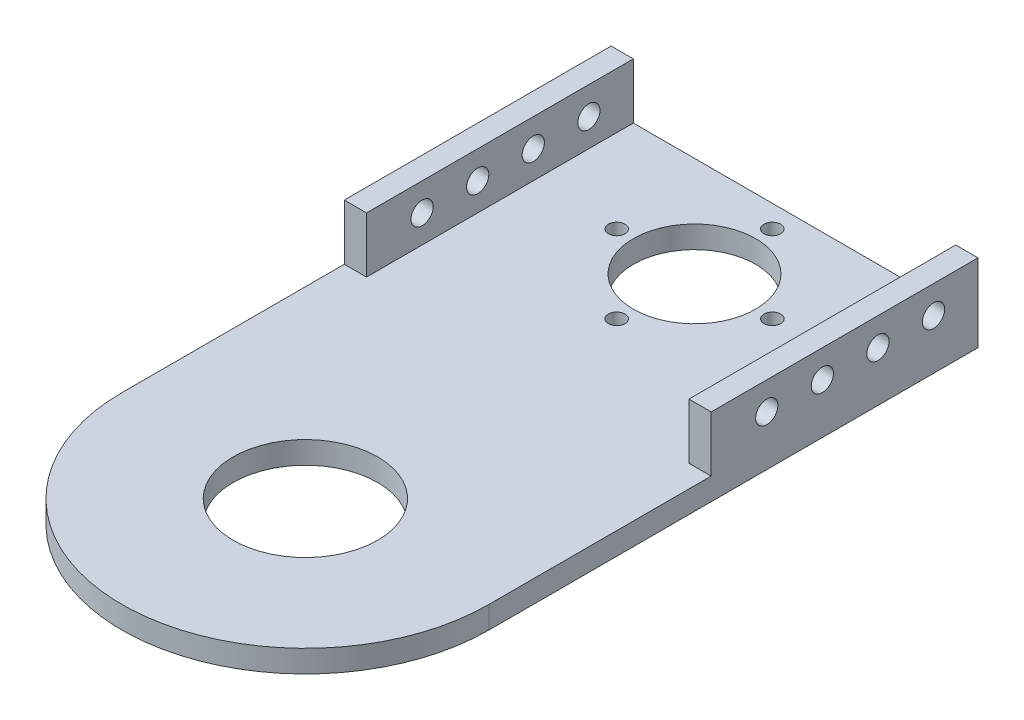
from build123d import *

# Parameters (mm, degrees)
EXTRUDE_1_DEPTH     = 30
CUT_EXTRUDE_1_REACH = 75.838
SKETCH_2_R          = 2
SKETCH_3_R          = 11
SKETCH_3_R_2        = 1.5
CUT_EXTRUDE_2_DEPTH = 4
SKETCH_4_R          = 13
EXTRUDE_2_DEPTH     = 4
CUT_EXTRUDE_3_REACH = 125.13
SKETCH_5_W          = 12
SKETCH_5_H          = 14


with BuildPart() as part:
    # 草图1 → 凸台-拉伸1 (new, symmetric)
    with BuildSketch(Plane.XY):
        Polygon((33, 0), (-33, 0), (-33, 14), (-29, 14), (-29, 4), (29, 4), (29, 14), (33, 14), align=None)
    extrude(amount=EXTRUDE_1_DEPTH, both=True)

    # 切除-拉伸1: up to this face of the body (flat: up to its plane)
    cut_extrude_1_end = Plane(part.part.faces().sort_by_distance((-33, 7, 0))[0])
    # 草图2 → 切除-拉伸1 (cut, up to the picked face)
    with BuildSketch(Plane(origin=(33, 0, 0), x_dir=(0, 0, -1), z_dir=(1, 0, 0)), mode=Mode.PRIVATE) as cut_extrude_1_sk1:
        with Locations((-20, 9)):
            Circle(SKETCH_2_R)
    cut_extrude_1_tool1 = split(extrude(cut_extrude_1_sk1.sketch, amount=-CUT_EXTRUDE_1_REACH, mode=Mode.PRIVATE), bisect_by=cut_extrude_1_end, keep=Keep.BOTH, mode=Mode.PRIVATE)
    # 草图2 → 切除-拉伸1 (cut, up to the picked face)
    with BuildSketch(Plane(origin=(33, 0, 0), x_dir=(0, 0, -1), z_dir=(1, 0, 0)), mode=Mode.PRIVATE) as cut_extrude_1_sk2:
        with Locations((-10, 9)):
            Circle(SKETCH_2_R)
    cut_extrude_1_tool2 = split(extrude(cut_extrude_1_sk2.sketch, amount=-CUT_EXTRUDE_1_REACH, mode=Mode.PRIVATE), bisect_by=cut_extrude_1_end, keep=Keep.BOTH, mode=Mode.PRIVATE)
    # 草图2 → 切除-拉伸1 (cut, up to the picked face)
    with BuildSketch(Plane(origin=(33, 0, 0), x_dir=(0, 0, -1), z_dir=(1, 0, 0)), mode=Mode.PRIVATE) as cut_extrude_1_sk3:
        with Locations(Location((10, 9, 0), (0, 0, 90))):
            Circle(SKETCH_2_R)
    cut_extrude_1_tool3 = split(extrude(cut_extrude_1_sk3.sketch, amount=-CUT_EXTRUDE_1_REACH, mode=Mode.PRIVATE), bisect_by=cut_extrude_1_end, keep=Keep.BOTH, mode=Mode.PRIVATE)
    # 草图2 → 切除-拉伸1 (cut, up to the picked face)
    with BuildSketch(Plane(origin=(33, 0, 0), x_dir=(0, 0, -1), z_dir=(1, 0, 0)), mode=Mode.PRIVATE) as cut_extrude_1_sk4:
        with Locations((0, 9)):
            Circle(SKETCH_2_R)
    cut_extrude_1_tool4 = split(extrude(cut_extrude_1_sk4.sketch, amount=-CUT_EXTRUDE_1_REACH, mode=Mode.PRIVATE), bisect_by=cut_extrude_1_end, keep=Keep.BOTH, mode=Mode.PRIVATE)
    add(cut_extrude_1_tool1.solids().sort_by(Axis((33, 9, 20), (-1, 0, 0)))[0], mode=Mode.SUBTRACT)
    add(cut_extrude_1_tool2.solids().sort_by(Axis((33, 9, 10), (-1, 0, 0)))[0], mode=Mode.SUBTRACT)
    add(cut_extrude_1_tool3.solids().sort_by(Axis((33, 9, -10), (-1, 0, 0)))[0], mode=Mode.SUBTRACT)
    add(cut_extrude_1_tool4.solids().sort_by(Axis((33, 9, 0), (-1, 0, 0)))[0], mode=Mode.SUBTRACT)

    # 草图3 → 切除-拉伸2 (cut)
    with BuildSketch(Plane(origin=(0, 4, 0), x_dir=(1, 0, 0), z_dir=(0, 1, 0))):
        with Locations(Location((0, 0, 0), (0, 0, 270))):
            Circle(SKETCH_3_R)
        with Locations(Location((0, 14, 0), (0, 0, 270))):
            Circle(SKETCH_3_R_2)
        with Locations(Location((14, 0, 0), (0, 0, 270))):
            Circle(SKETCH_3_R_2)
        with Locations(Location((0, -14, 0), (0, 0, 270))):
            Circle(SKETCH_3_R_2)
        with Locations(Location((-14, 0, 0), (0, 0, 270))):
            Circle(SKETCH_3_R_2)
    extrude(amount=-CUT_EXTRUDE_2_DEPTH, mode=Mode.SUBTRACT)

    # 草图4 → 凸台-拉伸2 (add)
    with BuildSketch(Plane.XZ):
        with BuildLine():
            Line((-33, 30), (33, 30))
            Line((33, 30), (33, 70))
            ThreePointArc((33, 70), (0, 103), (-33, 70))
            Line((-33, 70), (-33, 30))
        make_face()
        with Locations(Location((0, 70, 0), (0, 0, 270))):
            Circle(SKETCH_4_R, mode=Mode.SUBTRACT)
    extrude(amount=-EXTRUDE_2_DEPTH)

    # 切除-拉伸3: up to this face of the body (flat: up to its plane)
    cut_extrude_3_end = Plane(part.part.faces().sort_by_distance((-33, 6.051807691, 8.158777474))[0])
    # 草图5 → 切除-拉伸3 (cut, up to the picked face)
    with BuildSketch(Plane(origin=(33, 0, 0), x_dir=(0, 0, -1), z_dir=(1, 0, 0)), mode=Mode.PRIVATE) as cut_extrude_3_sk1:
        with Locations((24, 7)):
            Rectangle(SKETCH_5_W, SKETCH_5_H)
    cut_extrude_3_tool1 = split(extrude(cut_extrude_3_sk1.sketch, amount=-CUT_EXTRUDE_3_REACH, mode=Mode.PRIVATE), bisect_by=cut_extrude_3_end, keep=Keep.BOTH, mode=Mode.PRIVATE)
    add(cut_extrude_3_tool1.solids().sort_by(Axis((33, 7, -24), (-1, 0, 0)))[0], mode=Mode.SUBTRACT)


solid = part.part
